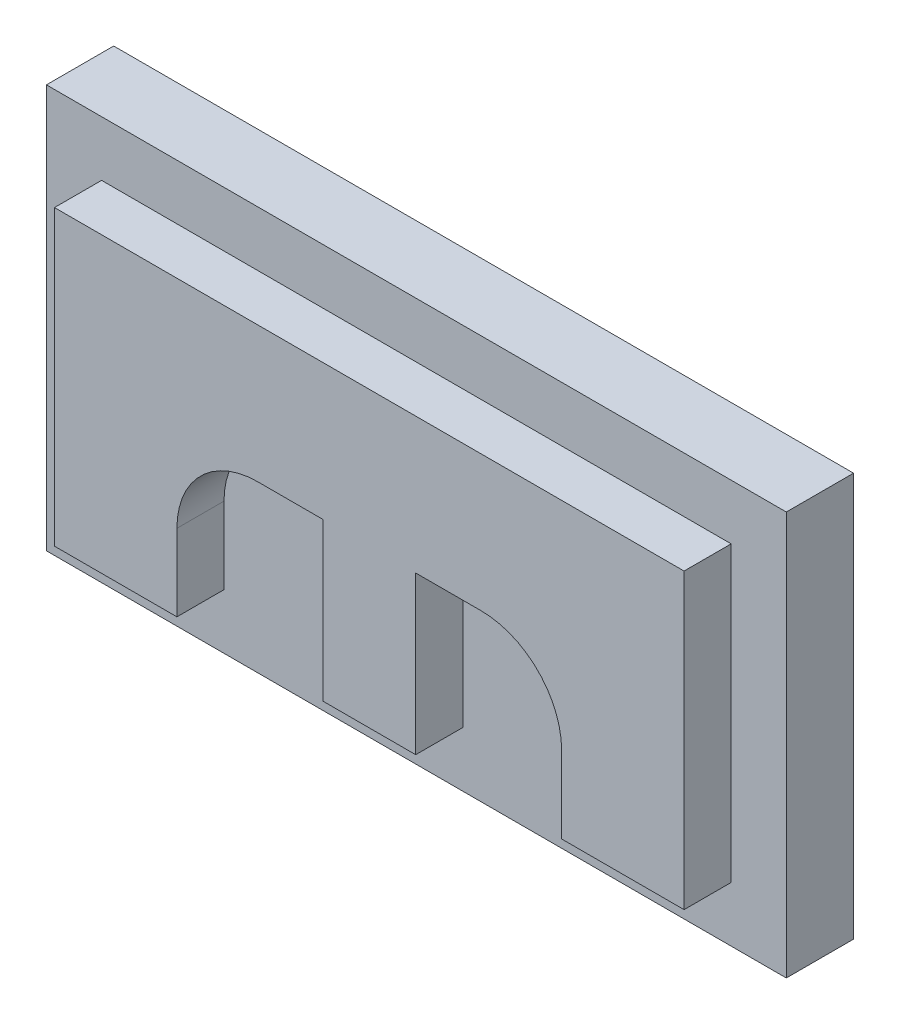
from build123d import *

# Parameters (mm, degrees)
SKETCH1_W            = 110
SKETCH1_H            = 60
BOSS_EXTRUDE1_DEPTH  = 10
SKETCH2_W            = 93.6
SKETCH2_H            = 43.6
BOSS_EXTRUDE3_DEPTH  = 7
SKETCH3_W            = 21.7
SKETCH3_H            = 23.4
CUT_EXTRUDE1_DEPTH   = 7
FILLET1_R            = 12
FILLET1_OF_MIRROR1_R = 12


with BuildPart() as part:
    # Sketch1 → Boss-Extrude1 (new body)
    with BuildSketch(Plane.XY):
        with Locations((55, 30)):
            Rectangle(SKETCH1_W, SKETCH1_H)
    extrude(amount=BOSS_EXTRUDE1_DEPTH)

    # Sketch2 → Boss-Extrude3 (add)
    with BuildSketch(Plane.XY.offset(10)):
        with Locations((55, 30)):
            Rectangle(SKETCH2_W, SKETCH2_H)
    extrude(amount=BOSS_EXTRUDE3_DEPTH)

    # Sketch3 → Cut-Extrude1 (cut)
    with BuildSketch(Plane.XY.offset(17)):
        with Locations((37.25, 19.9)):
            Rectangle(SKETCH3_W, SKETCH3_H)
    cut_extrude1 = extrude(amount=-CUT_EXTRUDE1_DEPTH, mode=Mode.SUBTRACT)

    # Fillet1
    fillet1_edges = [part.edges().sort_by_distance(p)[0] for p in [
        (26.4, 31.6, 13.5),
    ]]
    fillet(fillet1_edges, radius=FILLET1_R)

    # Mirror1: Cut-Extrude1 across plane
    add(cut_extrude1.mirror(Plane(origin=(55, 0, 0), x_dir=(0, 0, 1), z_dir=(1, 0, 0))), mode=Mode.SUBTRACT)

    # Fillet1 of Mirror1
    fillet1_of_mirror1_edges = [part.edges().sort_by_distance(p)[0] for p in [
        (83.6, 31.6, 13.5),
    ]]
    fillet(fillet1_of_mirror1_edges, radius=FILLET1_OF_MIRROR1_R)


solid = part.part
